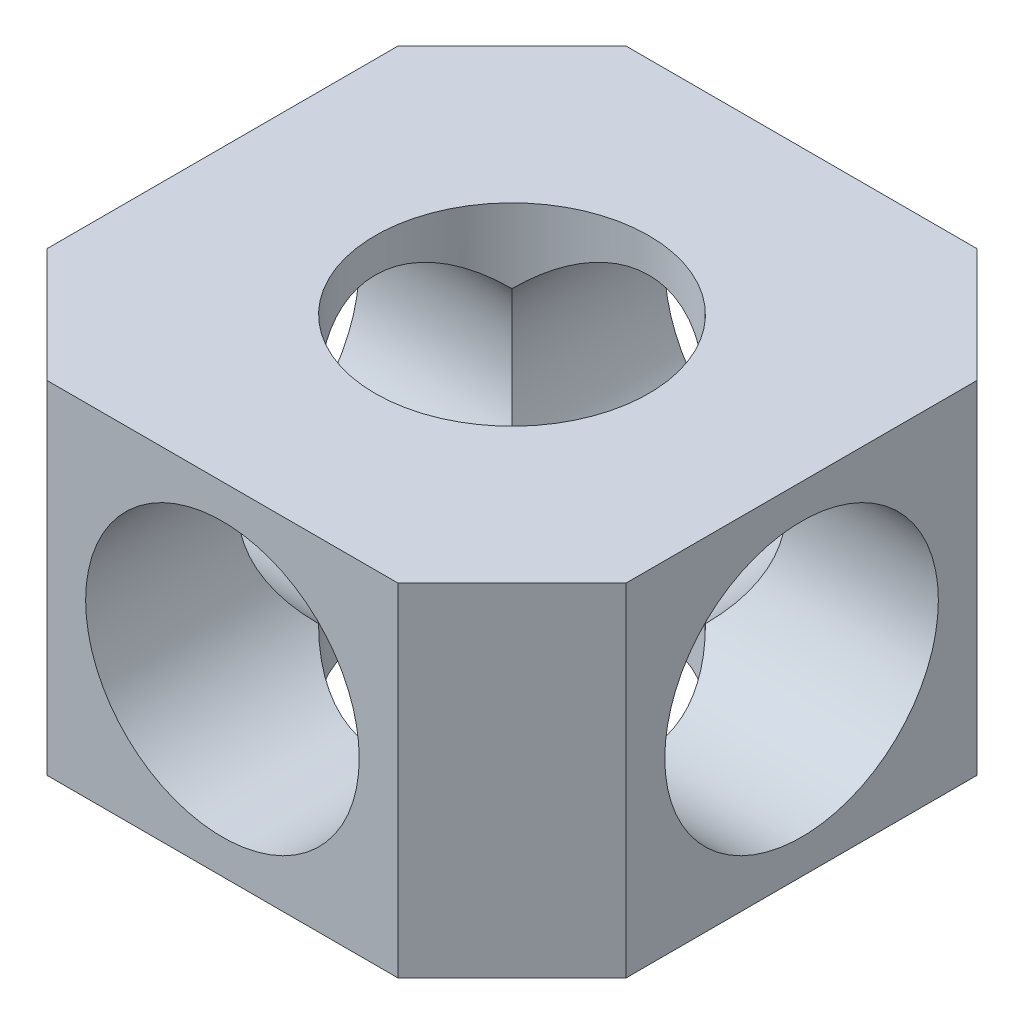
from build123d import *

# Parameters (mm, degrees)
SKETCH1_W           = 645.16
SKETCH1_H           = 645.16
BOSS_EXTRUDE1_DEPTH = 190.5
CHAMFER1_SIZE       = 127
SKETCH2_R           = 152.4
CUT_EXTRUDE1_DEPTH  = 595.370854602
SKETCH3_R           = 152.4
CUT_EXTRUDE2_DEPTH  = 747.042580554
CIRPATTERN1_COUNT   = 4


with BuildPart() as part:
    # Sketch1 → Boss-Extrude1 (new, symmetric)
    with BuildSketch(Plane(origin=(0, 0, 0), x_dir=(1, 0, 0), z_dir=(0, 1, 0))):
        Rectangle(SKETCH1_W, SKETCH1_H)
    extrude(amount=BOSS_EXTRUDE1_DEPTH, both=True)

    # Chamfer1
    chamfer1_edges = [part.edges().sort_by_distance(p)[0] for p in [
        (322.58, 0, 322.58),
        (-322.58, 0, 322.58),
        (-322.58, 0, -322.58),
        (322.58, 0, -322.58),
    ]]
    chamfer(chamfer1_edges, length=CHAMFER1_SIZE)

    # Sketch2 → Cut-Extrude1 (cut, through all)
    with BuildSketch(Plane(origin=(0, 190.5, 0), x_dir=(1, 0, 0), z_dir=(0, 1, 0))):
        with Locations(Location((0, 0, 0), (0, 0, 270))):
            Circle(SKETCH2_R)
    extrude(amount=-CUT_EXTRUDE1_DEPTH, mode=Mode.SUBTRACT)

    # Sketch3 → Cut-Extrude2 (cut, through all)
    with BuildSketch(Plane.XY.offset(322.58)):
        Circle(SKETCH3_R)
    cut_extrude2 = extrude(amount=-CUT_EXTRUDE2_DEPTH, mode=Mode.SUBTRACT)

    # CirPattern1: Cut-Extrude2 ×4 about axis
    cirpattern1_axis = Axis((0, -190.5, 0), (0, 1, 0))
    for i in range(1, CIRPATTERN1_COUNT):
        add(cut_extrude2.rotate(cirpattern1_axis, i * 360 / CIRPATTERN1_COUNT), mode=Mode.SUBTRACT)


solid = part.part
